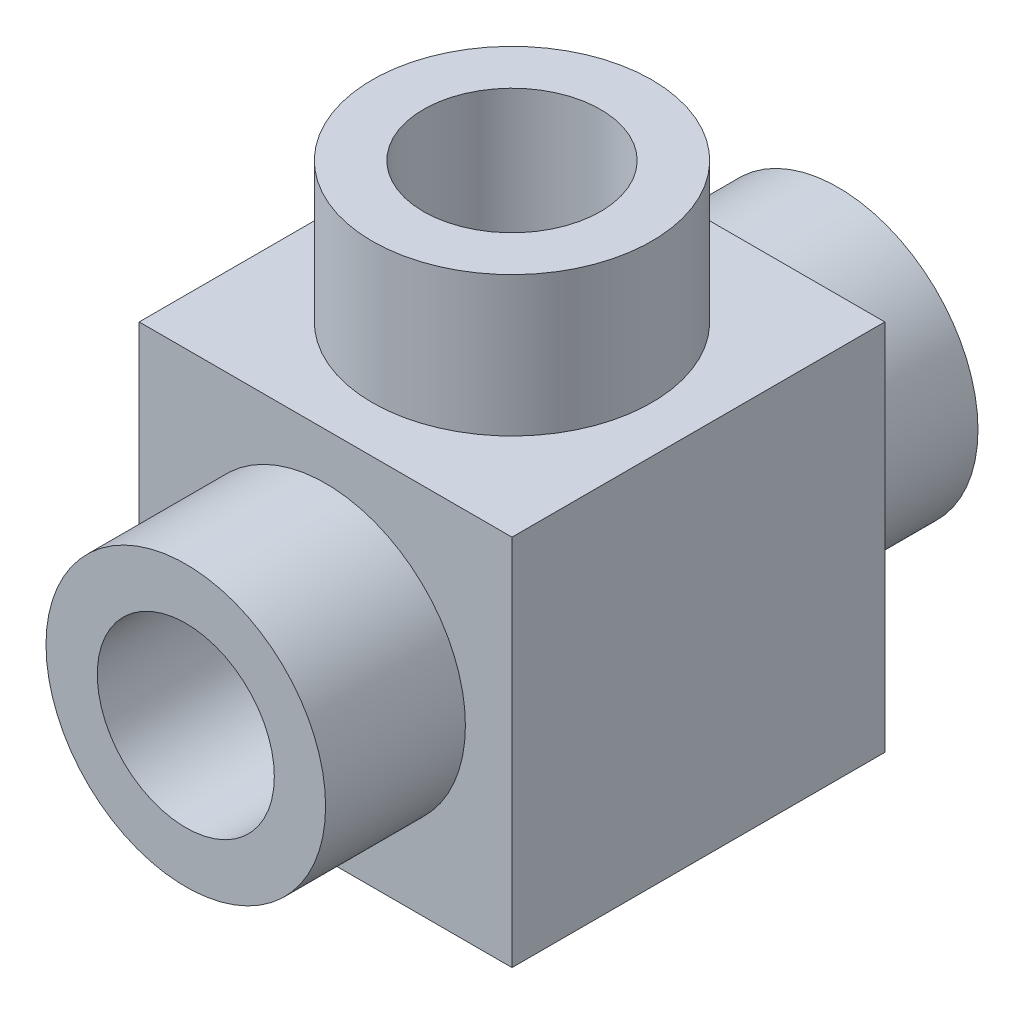
from build123d import *

# Parameters (mm, degrees)
CROQUIS1_R              = 30
CROQUIS1_R_2            = 19
SALIENTE_EXTRUIR1_DEPTH = 30
CROQUIS2_W              = 80
CROQUIS2_H              = 80
SALIENTE_EXTRUIR2_DEPTH = 80
CROQUIS4_R              = 30
CROQUIS4_R_2            = 19
SALIENTE_EXTRUIR4_DEPTH = 30
SALIENTE_EXTRUIR6_START = -30
CROQUIS6_R              = 30
CROQUIS6_R_2            = 19
SALIENTE_EXTRUIR6_DEPTH = 30


with BuildPart() as part:
    # Croquis1 → Saliente-Extruir1 (new body)
    with BuildSketch(Plane.XY):
        Circle(CROQUIS1_R)
        Circle(CROQUIS1_R_2, mode=Mode.SUBTRACT)
    extrude(amount=SALIENTE_EXTRUIR1_DEPTH)

    # Croquis2 → Saliente-Extruir2 (add)
    with BuildSketch(Plane.XY):
        Rectangle(CROQUIS2_W, CROQUIS2_H)
    extrude(amount=-SALIENTE_EXTRUIR2_DEPTH)

    # Croquis4 → Saliente-Extruir4 (add)
    with BuildSketch(Plane(origin=(0, 40, 0), x_dir=(1, 0, 0), z_dir=(0, 1, 0))):
        with Locations(Location((0, 40, 0), (0, 0, 270))):
            Circle(CROQUIS4_R)
        with Locations(Location((0, 40, 0), (0, 0, 270))):
            Circle(CROQUIS4_R_2, mode=Mode.SUBTRACT)
    extrude(amount=SALIENTE_EXTRUIR4_DEPTH)

    # Croquis6 → Saliente-Extruir6 (add)
    with BuildSketch(Plane.XY.offset(-80).offset(SALIENTE_EXTRUIR6_START)):
        with Locations(Location((0, 0, 0), (0, 0, 180))):
            Circle(CROQUIS6_R)
        Circle(CROQUIS6_R_2, mode=Mode.SUBTRACT)
    extrude(amount=SALIENTE_EXTRUIR6_DEPTH)


solid = part.part
